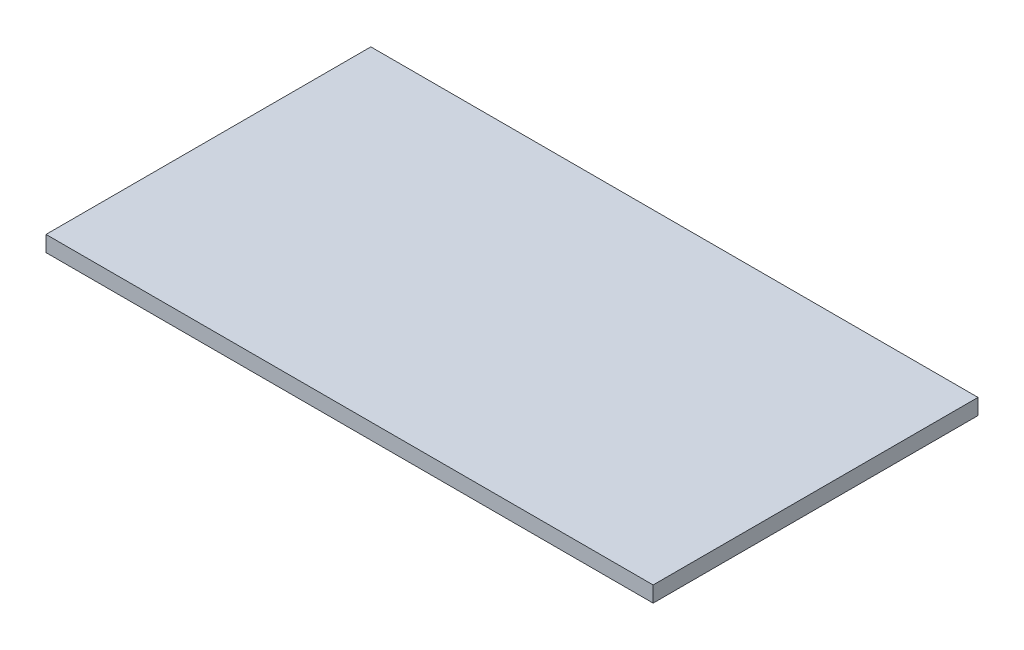
from build123d import *

# Parameters (mm, degrees)
SKETCH1_W           = 3850
SKETCH1_H           = 2060
BOSS_EXTRUDE1_DEPTH = 100
SKETCH1_5_W         = 3650
SKETCH1_5_H         = 1860
CUT_EXTRUDE4_DEPTH  = 60


with BuildPart() as part:
    # Sketch1 → Boss-Extrude1 (new body)
    with BuildSketch(Plane(origin=(0, 0, 0), x_dir=(1, 0, 0), z_dir=(0, 1, 0))):
        Rectangle(SKETCH1_W, SKETCH1_H)
    extrude(amount=BOSS_EXTRUDE1_DEPTH)

    # Sketch1<5> → Cut-Extrude4 (cut)
    with BuildSketch(Plane(origin=(0, 0, 0), x_dir=(1, 0, 0), z_dir=(0, 1, 0))):
        Rectangle(SKETCH1_5_W, SKETCH1_5_H)
    extrude(amount=CUT_EXTRUDE4_DEPTH, mode=Mode.SUBTRACT)


solid = part.part
